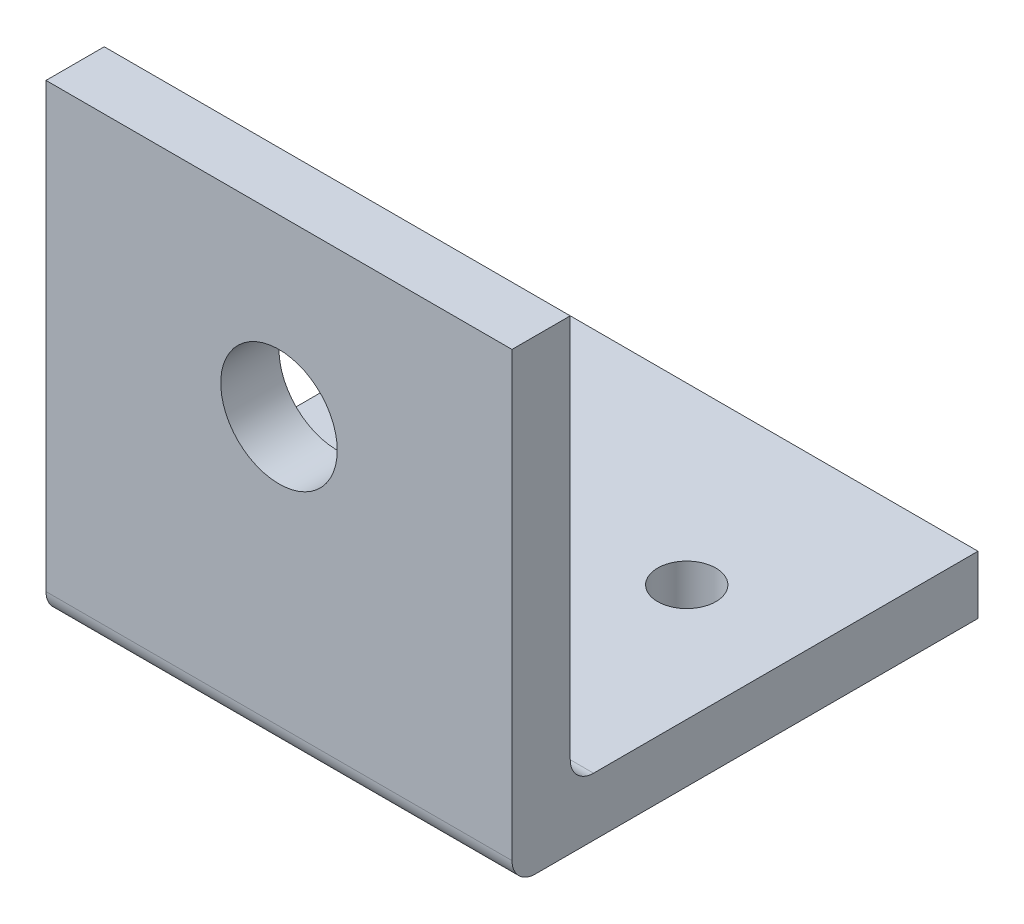
from build123d import *

# Parameters (mm, degrees)
Y_KSEKLIK_EKSTR_ZYON1_DEPTH = 40
RADYUS1_R                   = 2
IZIM2_R                     = 5
KES_EKSTR_ZYON1_DEPTH       = 69.507702566
IZIM3_R                     = 2.5
KES_EKSTR_ZYON2_DEPTH       = 58.563886053


with BuildPart() as part:
    # Çizim1 → Yükseklik-Ekstrüzyon1 (new body)
    with BuildSketch(Plane(origin=(0, 0, 0), x_dir=(0, 0, -1), z_dir=(1, 0, 0))):
        with BuildLine():
            Line((-17.895679663, 38.643308746), (-17.895679663, 0.643308746))
            ThreePointArc((-17.895679663, 0.643308746), (-17.309893225, -0.770904816), (-15.895679663, -1.356691254))
            Line((-15.895679663, -1.356691254), (22.104320337, -1.356691254))
            Line((22.104320337, -1.356691254), (22.104320337, 3.643308746))
            Line((22.104320337, 3.643308746), (-12.895679663, 3.643308746))
            Line((-12.895679663, 3.643308746), (-12.895679663, 38.643308746))
            Line((-12.895679663, 38.643308746), (-17.895679663, 38.643308746))
        make_face()
    extrude(amount=Y_KSEKLIK_EKSTR_ZYON1_DEPTH)

    # Radyus1
    radyus1_edges = [part.edges().sort_by_distance(p)[0] for p in [
        (20, 3.643308746, 12.895679663),
    ]]
    fillet(radyus1_edges, radius=RADYUS1_R)

    # Çizim2 → Kes-Ekstrüzyon1 (cut, through all)
    with BuildSketch(Plane.XY.offset(17.895679663)):
        with Locations((20, 23.643308746)):
            Circle(IZIM2_R)
    extrude(amount=-KES_EKSTR_ZYON1_DEPTH, mode=Mode.SUBTRACT)

    # Çizim3 → Kes-Ekstrüzyon2 (cut, through all)
    with BuildSketch(Plane(origin=(0, 3.643308746, 0), x_dir=(1, 0, 0), z_dir=(0, 1, 0))):
        with Locations(Location((10, 7.104320337, 0), (0, 0, 270))):
            Circle(IZIM3_R)
        with Locations(Location((30, 7.104320337, 0), (0, 0, 270))):
            Circle(IZIM3_R)
    extrude(amount=-KES_EKSTR_ZYON2_DEPTH, mode=Mode.SUBTRACT)


solid = part.part
